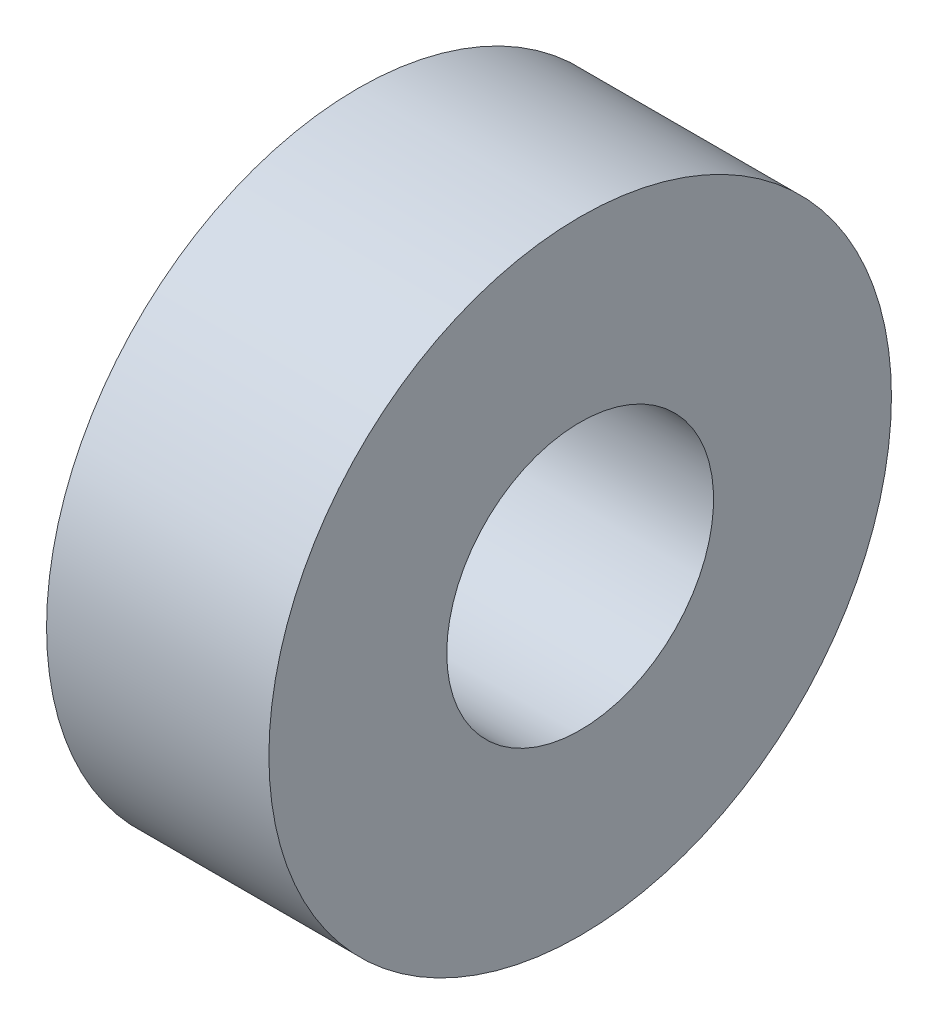
from build123d import *

# Parameters (mm, degrees)
SKETCH1_W = 5
SKETCH1_H = 4


with BuildPart() as part:
    # Sketch1 → Revolve1 (revolve)
    with BuildSketch(Plane.XY, mode=Mode.PRIVATE) as revolve1_sk:
        with Locations((2.5, 5)):
            Rectangle(SKETCH1_W, SKETCH1_H)
    revolve(revolve1_sk.sketch.rotate(Axis((0, 0, 0), (1, 0, 0)), 90), axis=Axis((0, 0, 0), (1, 0, 0)))


solid = part.part
